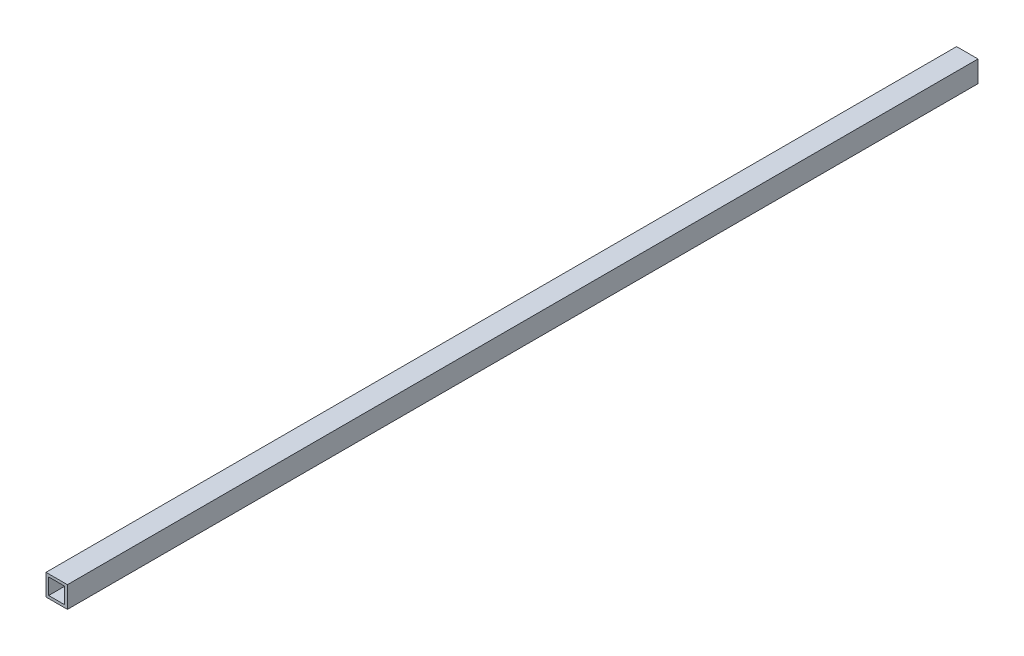
from build123d import *

# Parameters (mm, degrees)
SKETCH_1_W      = 40
SKETCH_1_H      = 40
EXTRUDE_1_DEPTH = 1700
SHELL_1_T       = -5


with BuildPart() as part:
    # 草图1 → 凸台-拉伸1 (new body)
    with BuildSketch(Plane.XY):
        Rectangle(SKETCH_1_W, SKETCH_1_H)
    extrude(amount=EXTRUDE_1_DEPTH)

    # 抽壳1
    shell_1_openings = [part.faces().sort_by_distance(p)[0] for p in [
        (0, 0, 1700),
        (0, 0, 0),
    ]]
    offset(amount=SHELL_1_T, openings=shell_1_openings, kind=Kind.INTERSECTION)


solid = part.part
